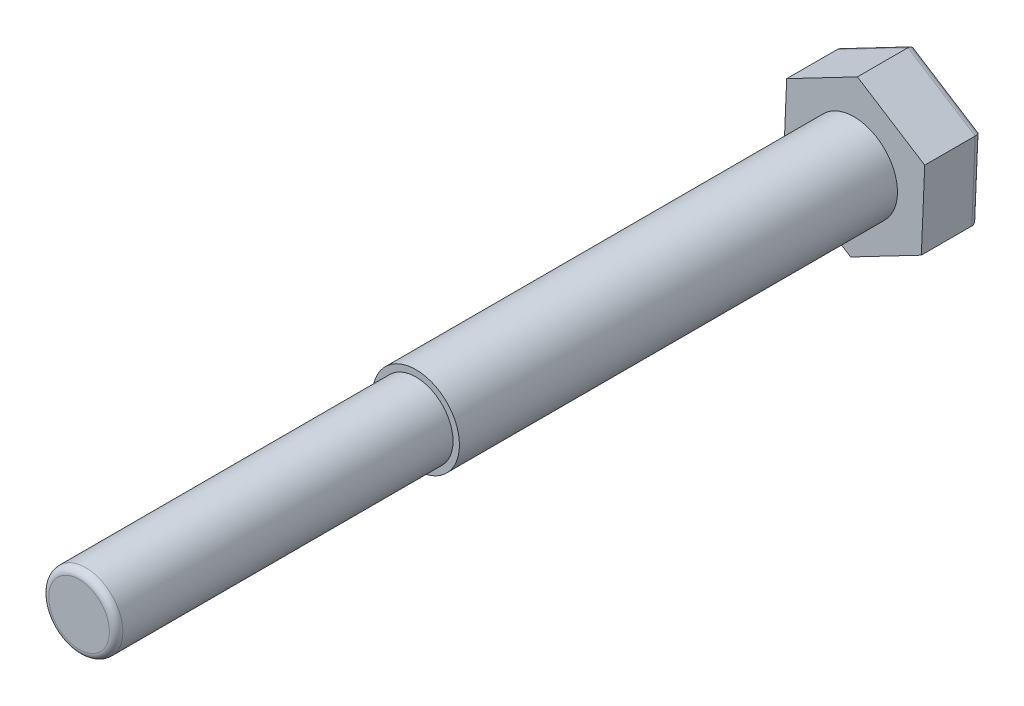
from build123d import *

# Parameters (mm, degrees)
EXTRUDE_372_DEPTH = 17
SKETCH_2_R        = 12.9
EXTRUDE_1_DEPTH   = 130
FILLET_3_R        = 2
SKETCH_3_R        = 11
EXTRUDE_2_DEPTH   = 100
FILLET_4_R        = 2


with BuildPart() as part:
    # 草图1 → Extrude 372 (new body)
    with BuildSketch(Plane.XY):
        Polygon((20.984201837, 10.954296262), (1.005402075, 23.65), (-19.978799762, 12.695703738), (-20.984201837, -10.954296262), (-1.005402075, -23.65), (19.978799762, -12.695703738), align=None)
    extrude(amount=EXTRUDE_372_DEPTH)

    # 草图2 → 凸台-拉伸1 (add)
    with BuildSketch(Plane.XY.offset(17)):
        with Locations(Location((0, 0, 0), (0, 0, 180))):
            Circle(SKETCH_2_R)
    extrude(amount=EXTRUDE_1_DEPTH)

    # 圆角3
    fillet_3_edges = [part.edges().sort_by_distance(p)[0] for p in [
        (9.486698843, -18.172851869, 0),
        (-10.994801956, -17.302148131, 0),
        (-20.4815008, 0.870703738, 0),
        (-9.486698843, 18.172851869, 0),
        (10.994801956, 17.302148131, 0),
        (20.4815008, -0.870703738, 0),
    ]]
    fillet(fillet_3_edges, radius=FILLET_3_R)

    # 草图3 → 凸台-拉伸2 (add)
    with BuildSketch(Plane.XY.offset(147)):
        Circle(SKETCH_3_R)
    extrude(amount=EXTRUDE_2_DEPTH)

    # 圆角4
    fillet_4_edges = [part.edges().sort_by_distance(p)[0] for p in [
        (-11, 0, 247),
    ]]
    fillet(fillet_4_edges, radius=FILLET_4_R)


solid = part.part
